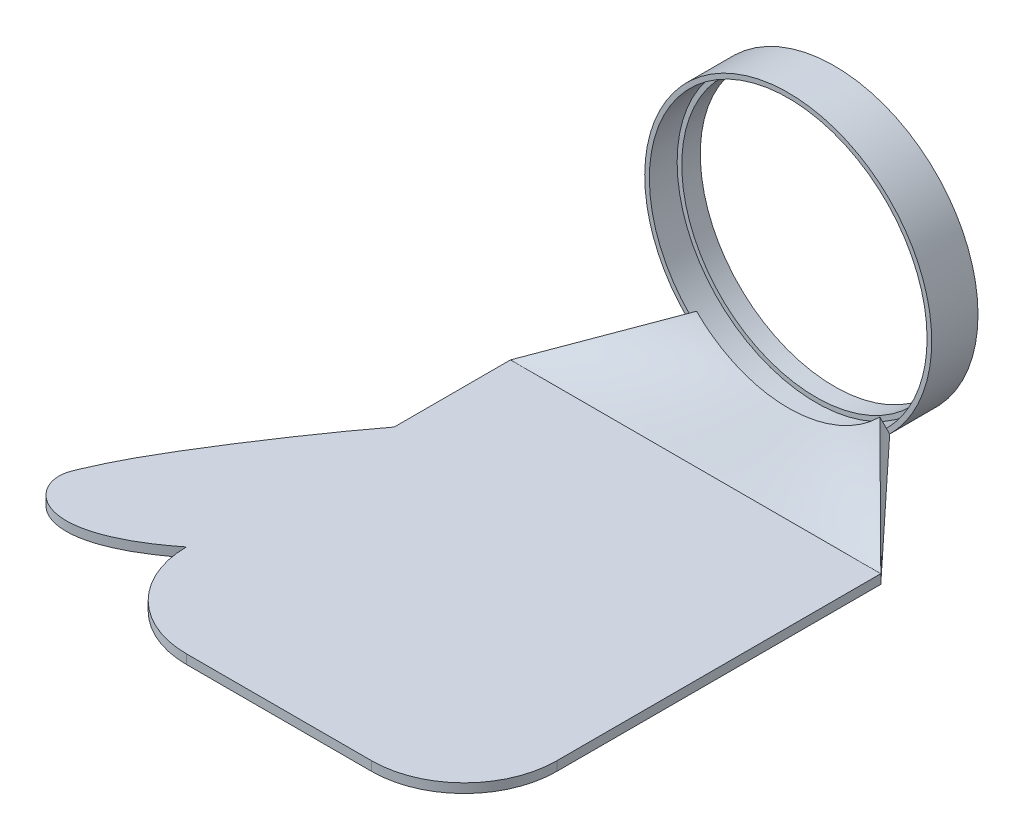
from build123d import *

# Parameters (mm, degrees)
SKETCH1_R                = 15
SKETCH1_R_2              = 14.5
BOSS_EXTRUDE1_DEPTH      = 2
BOSS_EXTRUDE2_DEPTH      = 3
BOSS_EXTRUDE2_DEPTH_BACK = 2
SKETCH2_R                = 15.5
SKETCH2_R_2              = 15
SKETCH5_W                = 40
SKETCH5_H                = 1
BOSS_EXTRUDE3_DEPTH      = 45
FILLET1_R                = 10
BOSS_EXTRUDE4_DEPTH      = 1


with BuildPart() as part:
    # Sketch1 → Boss-Extrude1 (new body)
    with BuildSketch(Plane.XY):
        Circle(SKETCH1_R)
        Circle(SKETCH1_R_2, mode=Mode.SUBTRACT)
    extrude(amount=BOSS_EXTRUDE1_DEPTH)

    # Sketch2 → Boss-Extrude2 (add, two sides: drawn at the far end of the back side and taken through both)
    with BuildSketch(Plane.XY.offset(2).offset(-BOSS_EXTRUDE2_DEPTH_BACK)):
        Circle(SKETCH2_R)
        Circle(SKETCH2_R_2, mode=Mode.SUBTRACT)
    extrude(amount=BOSS_EXTRUDE2_DEPTH + BOSS_EXTRUDE2_DEPTH_BACK)

    # Sketch4 → Loft1 section 0
    with BuildSketch(Plane.XY.offset(15)):
        with BuildLine():
            Line((-20, -15.5), (20, -15.5))
            Line((20, -15.5), (20, -14.5))
            Line((20, -14.5), (-20, -14.5))
            Line((-20, -14.5), (-20, -15.5))
        make_face()
    # Sketch3 for Loft1 → Loft1 section 1
    with BuildSketch(Plane.XY.offset(5)):
        with BuildLine():
            Line((-9.899494937, -9.899494937), (-10.960155108, -10.960155108))
            # circular arc as an exact rational Bezier (weights 1, cos(half-angle), 1)
            Bezier((-10.960155108, -10.960155108), (0, -21.920310217), (10.960155108, -10.960155108), weights=[1, 0.707106781, 1])
            Line((10.960155108, -10.960155108), (9.899494937, -9.899494937))
            Bezier((9.899494937, -9.899494937), (0, -19.798989873), (-9.899494937, -9.899494937), weights=[1, 0.707106781, 1])
        make_face()
    loft()

    # Sketch5 → Boss-Extrude3 (add)
    with BuildSketch(Plane.XY.offset(15)):
        with Locations((0, -15)):
            Rectangle(SKETCH5_W, SKETCH5_H)
    extrude(amount=BOSS_EXTRUDE3_DEPTH)

    # Fillet1
    fillet1_edges = [part.edges().sort_by_distance(p)[0] for p in [
        (-20, -15, 60),
        (20, -15, 60),
    ]]
    fillet(fillet1_edges, radius=FILLET1_R)

    # Sketch6 → Boss-Extrude4 (add)
    with BuildSketch(Plane(origin=(0, -14.5, 0), x_dir=(1, 0, 0), z_dir=(0, 1, 0))):
        with BuildLine():
            Line((-20, -27.561598622), (-20, -50))
            add(Edge.make_bspline(
                [(-20, -27.561598622), (-23.684580214, -32.380435237), (-30.253613698, -42.286731283), (-33.147068254, -48.653521104), (-34.627998346, -52.209238413), (-29.246314481, -57.320630676), (-20, -50)],
                knots=[0, 0, 0, 0, 0.304772802, 0.350399974, 0.456271712, 1, 1, 1, 1], degree=3))
        make_face()
    extrude(amount=-BOSS_EXTRUDE4_DEPTH)


solid = part.part
